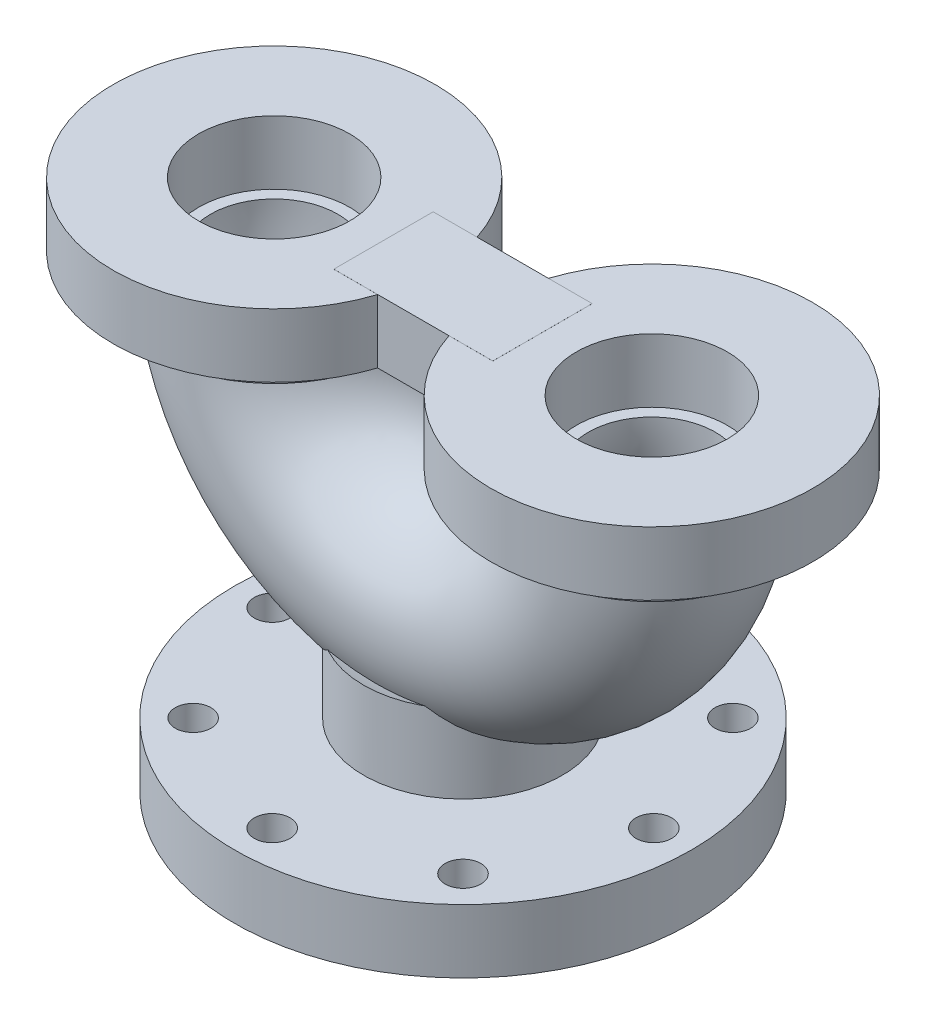
from build123d import *

# Parameters (mm, degrees)
SKETCH2_R           = 50
SKETCH2_R_2         = 32
SKETCH6_R           = 9
CUT_EXTRUDE3_DEPTH  = 243.045450402
SKETCH7_R           = 81
SKETCH7_R_2         = 38
BOSS_EXTRUDE1_DEPTH = 32
SKETCH9_R           = 62
SKETCH9_R_2         = 50
BOSS_EXTRUDE2_DEPTH = 14
SKETCH10_W          = 80
SKETCH10_H          = 50
BOSS_EXTRUDE3_DEPTH = 32
SKETCH10_2_W        = 80
SKETCH10_2_H        = 50
BOSS_EXTRUDE4_DEPTH = 0.02


with BuildPart() as part:
    # Sweep1: sweep along a path in Sketch1
    with BuildLine(Plane.XY) as sweep1_path:
        ThreePointArc((127, 0), (0, -127), (-127, 0))
    # Sketch2 → Sweep1 (sweep)
    with BuildSketch(Plane(origin=(0, 0, 0), x_dir=(1, 0, 0), z_dir=(0, 1, 0))):
        with Locations((95, 0)):
            Circle(SKETCH2_R)
        with Locations((95, 0)):
            Circle(SKETCH2_R_2, mode=Mode.SUBTRACT)
    sweep(path=sweep1_path.line)

    # Sketch7 → Boss-Extrude1 (add)
    # profile 1 of 2: a face of its own
    with BuildSketch(Plane(origin=(0, 0, 0), x_dir=(1, 0, 0), z_dir=(0, 1, 0))):
        with Locations(Location((-95, 0, 0), (0, 0, 180))):
            Circle(SKETCH7_R)
        with Locations(Location((-95, 0, 0), (0, 0, 180))):
            Circle(SKETCH7_R_2, mode=Mode.SUBTRACT)
    # profile 2 of 2: a face of its own
    with BuildSketch(Plane(origin=(0, 0, 0), x_dir=(1, 0, 0), z_dir=(0, 1, 0))):
        with Locations((95, 0)):
            Circle(SKETCH7_R)
        with Locations((95, 0)):
            Circle(SKETCH7_R_2, mode=Mode.SUBTRACT)
    extrude(amount=BOSS_EXTRUDE1_DEPTH)

    # Sketch9 → Boss-Extrude2 (add)
    # profile 1 of 2: a face of its own
    with BuildSketch(Plane(origin=(0, 0, 0), x_dir=(1, 0, 0), z_dir=(0, 1, 0))):
        with Locations(Location((-95, 0, 0), (0, 0, 180))):
            Circle(SKETCH9_R)
        with Locations((-95, 0)):
            Circle(SKETCH9_R_2, mode=Mode.SUBTRACT)
    # profile 2 of 2: a face of its own
    with BuildSketch(Plane(origin=(0, 0, 0), x_dir=(1, 0, 0), z_dir=(0, 1, 0))):
        with Locations((95, 0)):
            Circle(SKETCH9_R)
        with Locations((95, 0)):
            Circle(SKETCH9_R_2, mode=Mode.SUBTRACT)
    extrude(amount=-BOSS_EXTRUDE2_DEPTH)

    # Sketch10 → Boss-Extrude3 (add)
    with BuildSketch(Plane(origin=(0, 32, 0), x_dir=(1, 0, 0), z_dir=(0, 1, 0))):
        Rectangle(SKETCH10_W, SKETCH10_H)
    extrude(amount=-BOSS_EXTRUDE3_DEPTH)

    # Sketch10<2> → Boss-Extrude4 (add)
    with BuildSketch(Plane(origin=(0, 32, 0), x_dir=(1, 0, 0), z_dir=(0, 1, 0))):
        Rectangle(SKETCH10_2_W, SKETCH10_2_H)
    extrude(amount=BOSS_EXTRUDE4_DEPTH)


with BuildPart() as body_2:
    # Sketch3 → Revolve1 (revolve)
    with BuildSketch(Plane.XY):
        with BuildLine():
            ThreePointArc((50, -116.743308159), (25.520578596, -124.409405063), (0, -127))
            Line((0, -127), (0, -145))
            ThreePointArc((0, -145), (16.099545018, -144.103451209), (32, -141.424891727))
            Line((32, -141.424891727), (32, -156))
            Line((32, -156), (50, -156))
            Line((50, -156), (50, -116.743308159))
        make_face()
    revolve(axis=Axis((0, 0, 0), (0, -1, 0)))

    # Sketch3<6> → Revolve2 (revolve)
    with BuildSketch(Plane.XY, mode=Mode.PRIVATE) as revolve2_sk:
        Polygon((32, -156), (0, -156), (0, -188), (115, -188), (115, -156), (50, -156), align=None)
    revolve(revolve2_sk.sketch.rotate(Axis((0, 0, 0), (0, -1, 0)), 180), axis=Axis((0, 0, 0), (0, -1, 0)))

    # Sketch6 → Cut-Extrude3 (cut, through all)
    with BuildSketch(Plane(origin=(0, -156, 0), x_dir=(1, 0, 0), z_dir=(0, 1, 0))):
        with Locations(Location((0, 96, 0), (0, 0, 180))):
            Circle(SKETCH6_R)
        with Locations(Location((67.882250994, 67.882250994, 0), (0, 0, 180))):
            Circle(SKETCH6_R)
        with Locations(Location((96, 0, 0), (0, 0, 180))):
            Circle(SKETCH6_R)
        with Locations(Location((67.882250994, -67.882250994, 0), (0, 0, 180))):
            Circle(SKETCH6_R)
        with Locations(Location((0, -96, 0), (0, 0, 180))):
            Circle(SKETCH6_R)
        with Locations(Location((-67.882250994, -67.882250994, 0), (0, 0, 180))):
            Circle(SKETCH6_R)
        with Locations(Location((-96, 0, 0), (0, 0, 180))):
            Circle(SKETCH6_R)
        with Locations(Location((-67.882250994, 67.882250994, 0), (0, 0, 180))):
            Circle(SKETCH6_R)
    extrude(amount=-CUT_EXTRUDE3_DEPTH, mode=Mode.SUBTRACT)


solid = Compound([part.part, body_2.part])
